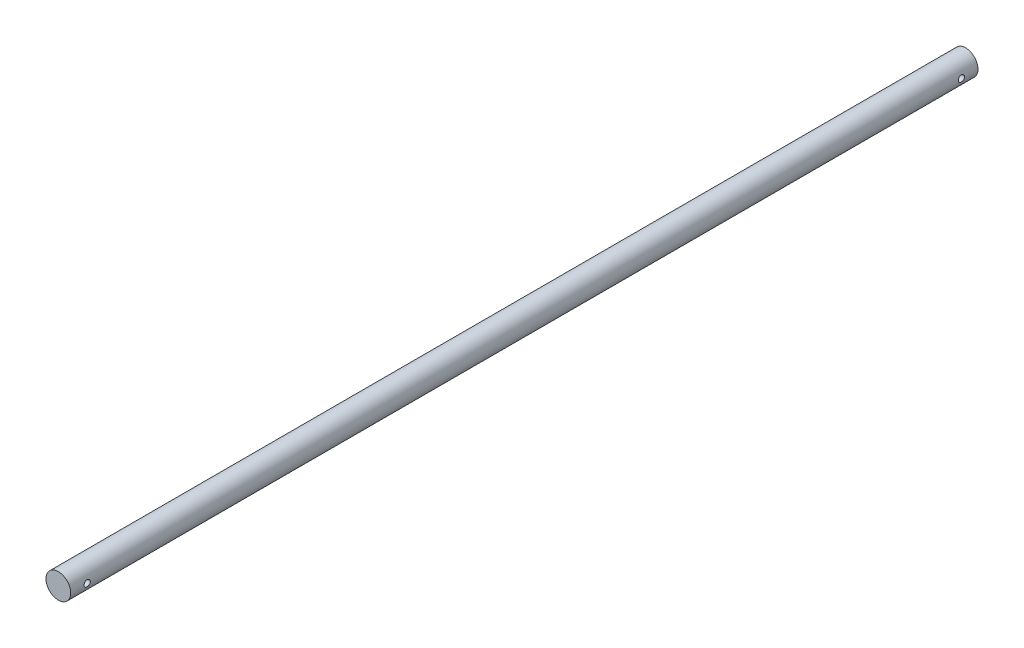
from build123d import *

# Parameters (mm, degrees)
SKETCH_1_R               = 3
EXTRUDE_1_DEPTH          = 220
CUT_EXTRUDE_1_DEPTH      = 221.040905288
CUT_EXTRUDE_1_DEPTH_BACK = 221.040905288
SKETCH_2_R               = 0.75


with BuildPart() as part:
    # 草图1 → 凸台-拉伸1 (new body)
    with BuildSketch(Plane.XY):
        Circle(SKETCH_1_R)
    extrude(amount=EXTRUDE_1_DEPTH)

    # 草图2 → 切除-拉伸1 (cut, two sides: drawn at the far end of the back side and taken through both)
    with BuildSketch(Plane(origin=(0, 0, 0), x_dir=(0, 0, -1), z_dir=(1, 0, 0)).offset(-CUT_EXTRUDE_1_DEPTH_BACK)):
        with Locations(Location((-4, 0, 0), (0, 0, 180))):
            Circle(SKETCH_2_R)
        with Locations(Location((-216, 0, 0), (0, 0, 180))):
            Circle(SKETCH_2_R)
    extrude(amount=CUT_EXTRUDE_1_DEPTH + CUT_EXTRUDE_1_DEPTH_BACK, mode=Mode.SUBTRACT)


solid = part.part
